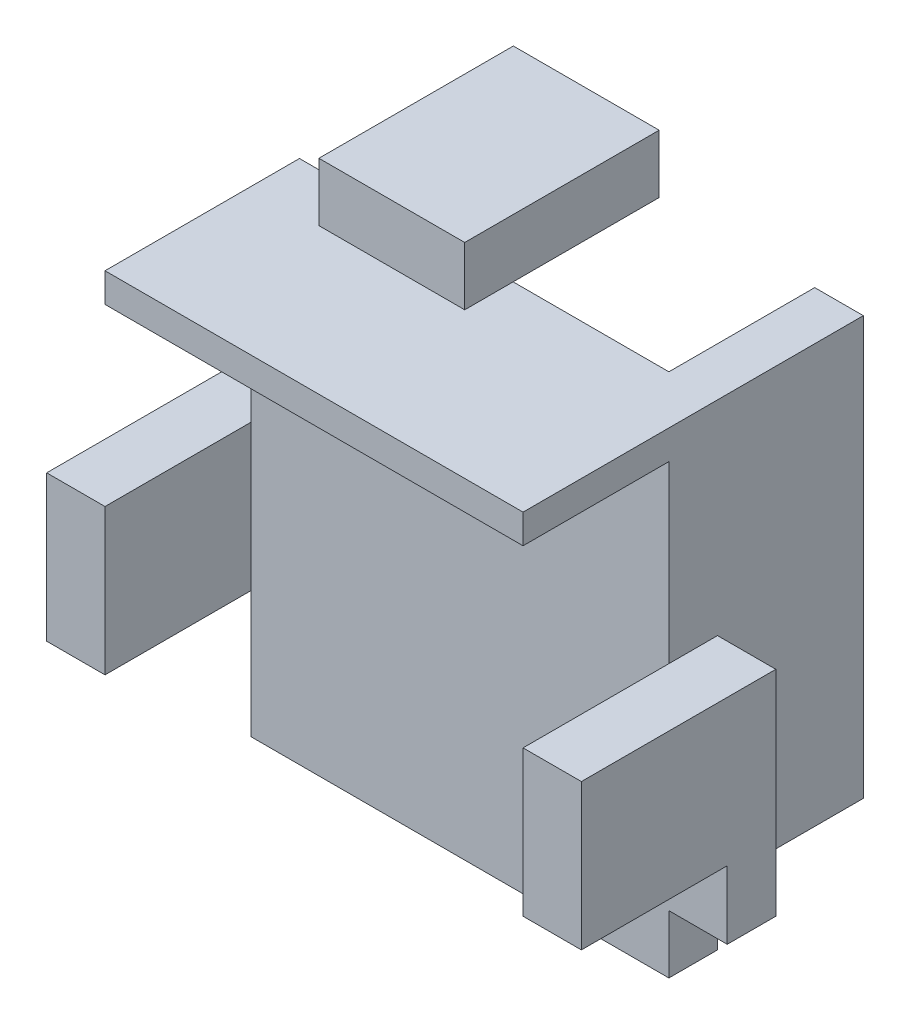
from build123d import *

# Parameters (mm, degrees)
SKETCH_1_W          = 6
SKETCH_1_H          = 15
EXTRUDE_3_DEPTH     = 15
SKETCH_1_7_W        = 6
SKETCH_1_7_H        = 15
EXTRUDE_3_2_DEPTH   = 15
EXTRUDE_4_DEPTH     = 15
SKETCH_1_11_W       = 18
SKETCH_1_11_H       = 18
SKETCH_1_11_W_2     = 6
SKETCH_1_11_H_2     = 15
SKETCH_1_11_W_3     = 15
SKETCH_1_11_H_3     = 6
SKETCH_1_11_W_4     = 7
EXTRUDE_5_DEPTH     = 5
SKETCH_1_13_W       = 3
SKETCH_1_13_H       = 40
EXTRUDE_10_DEPTH    = 20
SKETCH_3_W          = 14.869090603
SKETCH_3_H          = 6
EXTRUDE_15_DEPTH    = 15
SKETCH_4_W          = 22
SKETCH_4_H          = 6
SKETCH_4_W_2        = 7
CUT_EXTRUDE_2_DEPTH = 100.096671025
SKETCH_8_W          = 14.869090603
SKETCH_8_H          = 6
CUT_EXTRUDE_3_DEPTH = 104.17533721
SKETCH_10_W         = 15
SKETCH_10_H         = 6
EXTRUDE_16_DEPTH    = 20
SKETCH_15_W         = 7
SKETCH_15_H         = 6
EXTRUDE_17_DEPTH    = 5
SKETCH_16_W         = 15
SKETCH_16_H         = 6
EXTRUDE_18_DEPTH    = 20
SKETCH_17_W         = 3
SKETCH_17_H         = 40
CUT_EXTRUDE_5_DEPTH = 100.108727035
SKETCH_18_W         = 5
SKETCH_18_H         = 43
EXTRUDE_19_DEPTH    = 15


with BuildPart() as part:
    # 草图1 → Extrude 3 (new body)
    with BuildSketch(Plane.XY):
        with Locations((-25.796959303, 23.532605762)):
            Rectangle(SKETCH_1_W, SKETCH_1_H)
    extrude(amount=EXTRUDE_3_DEPTH)



with BuildPart() as body_2:
    # 草图1<7> → Extrude 3 2 (new body)
    with BuildSketch(Plane.XY):
        with Locations((-74.796959303, 23.532605762)):
            Rectangle(SKETCH_1_7_W, SKETCH_1_7_H)
    extrude(amount=EXTRUDE_3_2_DEPTH)


with BuildPart() as body_3:
    # 草图1<8> → 凸台-拉伸4 (new body)
    with BuildSketch(Plane.XY):
        Polygon((-71.796959303, 49.032605762), (-68.796959303, 49.032605762), (-50.796959303, 49.032605762), (-28.796959303, 49.032605762), (-28.796959303, 52.032605762), (-35.796959303, 52.032605762), (-50.796959303, 52.032605762), (-71.796959303, 52.032605762), align=None)
    extrude(amount=EXTRUDE_4_DEPTH)


with BuildPart() as part_1:
    add(part.part)

    add(body_2.part)  # 凸台-拉伸5 merges body 2

    add(body_3.part)  # 凸台-拉伸5 merges body 3
    # 草图1<11> → 凸台-拉伸5 (add)
    with BuildSketch(Plane.XY):
        Polygon((-68.796959303, 9.032605762), (-50.796959303, 9.032605762), (-35.796959303, 9.032605762), (-35.796959303, 3.032605762), (-28.796959303, 3.032605762), (-28.796959303, 9.032605762), (-22.796959303, 9.032605762), (-22.796959303, 16.032605762), (-28.796959303, 16.032605762), (-28.796959303, 31.032605762), (-28.796959303, 49.032605762), (-50.796959303, 49.032605762), (-50.796959303, 31.032605762), (-68.796959303, 31.032605762), align=None)
        with Locations((-59.796959303, 40.032605762)):
            Rectangle(SKETCH_1_11_W, SKETCH_1_11_H)
        with Locations((-25.796959303, 23.532605762)):
            Rectangle(SKETCH_1_11_W_2, SKETCH_1_11_H_2)
        with Locations((-74.796959303, 23.532605762)):
            Rectangle(SKETCH_1_11_W_2, SKETCH_1_11_H_2)
        Polygon((-71.796959303, 9.032605762), (-68.796959303, 9.032605762), (-68.796959303, 31.032605762), (-68.796959303, 49.032605762), (-71.796959303, 49.032605762), (-71.796959303, 31.032605762), (-71.796959303, 16.032605762), align=None)
        Polygon((-71.796959303, 49.032605762), (-68.796959303, 49.032605762), (-50.796959303, 49.032605762), (-28.796959303, 49.032605762), (-28.796959303, 52.032605762), (-35.796959303, 52.032605762), (-50.796959303, 52.032605762), (-71.796959303, 52.032605762), align=None)
        with Locations((-43.296959303, 55.032605762)):
            Rectangle(SKETCH_1_11_W_3, SKETCH_1_11_H_3)
        with Locations((-32.296959303, 55.032605762)):
            Rectangle(SKETCH_1_11_W_4, SKETCH_1_11_H_3)
        with Locations((-43.296959303, 6.032605762)):
            Rectangle(SKETCH_1_11_W_3, SKETCH_1_11_H_3)
    extrude(amount=-EXTRUDE_5_DEPTH)

    # 草图1<13> → 凸台-拉伸10 (add)
    with BuildSketch(Plane.XY):
        with Locations((-70.296959303, 29.032605762)):
            Rectangle(SKETCH_1_13_W, SKETCH_1_13_H)
    extrude(amount=-EXTRUDE_10_DEPTH)

    # 草图3 → 凸台-拉伸15 (add)
    with BuildSketch(Plane(origin=(0, 0, -5), x_dir=(-1, 0, 0), z_dir=(0, 0, -1))):
        with Locations((43.362414001, 55.032605762)):
            Rectangle(SKETCH_3_W, SKETCH_3_H)
        with Locations((43.362414001, 6.032605762)):
            Rectangle(SKETCH_3_W, SKETCH_3_H)
    extrude(amount=EXTRUDE_15_DEPTH)

    # 草图4 → 切除-拉伸2 (cut, through all)
    with BuildSketch(Plane(origin=(0, 0, -5), x_dir=(-1, 0, 0), z_dir=(0, 0, -1))):
        with Locations((39.796959303, 55.032605762)):
            Rectangle(SKETCH_4_W, SKETCH_4_H)
        with Locations((68.296959303, 55.032605762)):
            Rectangle(SKETCH_4_W_2, SKETCH_4_H)
    extrude(amount=-CUT_EXTRUDE_2_DEPTH, mode=Mode.SUBTRACT)


with BuildPart() as cut_extrude_2_piece_1:
    # of the separate pieces the step leaves, piece 1, a body of its own (cut_extrude_2_pieces)
    add(part_1.part.solids().sort_by_distance((-28.796959303, 31.032605762, 0))[0])

    # 草图15 → 凸台-拉伸17 (add)
    with BuildSketch(Plane.XY):
        with Locations((-68.296959303, 6.032605762)):
            Rectangle(SKETCH_15_W, SKETCH_15_H)
    extrude(amount=-EXTRUDE_17_DEPTH)

    # 草图16 → 凸台-拉伸18 (add)
    with BuildSketch(Plane.XY):
        with Locations((-57.296959303, 6.032605762)):
            Rectangle(SKETCH_16_W, SKETCH_16_H)
    extrude(amount=-EXTRUDE_18_DEPTH)

    # 草图17 → 切除-拉伸5 (cut, through all)
    with BuildSketch(Plane(origin=(0, 0, -5), x_dir=(-1, 0, 0), z_dir=(0, 0, -1))):
        with Locations((70.296959303, 29.032605762)):
            Rectangle(SKETCH_17_W, SKETCH_17_H)
    extrude(amount=CUT_EXTRUDE_5_DEPTH, mode=Mode.SUBTRACT)

    # 草图18 → 凸台-拉伸19 (add)
    with BuildSketch(Plane(origin=(0, 0, -5), x_dir=(-1, 0, 0), z_dir=(0, 0, -1))):
        with Locations((31.296959303, 30.532605762)):
            Rectangle(SKETCH_18_W, SKETCH_18_H)
    extrude(amount=EXTRUDE_19_DEPTH)


with BuildPart() as cut_extrude_2_piece_2:
    # of the separate pieces the step leaves, piece 2, a body of its own (cut_extrude_2_pieces)
    add(part_1.part.solids().sort_by_distance((-50.796959303, 52.032605762, -20))[0])

    # 草图8 → 切除-拉伸3 (cut, through all)
    with BuildSketch(Plane(origin=(0, 0, -20), x_dir=(-1, 0, 0), z_dir=(0, 0, -1))):
        with Locations((43.362414001, 55.032605762)):
            Rectangle(SKETCH_8_W, SKETCH_8_H)
    extrude(amount=-CUT_EXTRUDE_3_DEPTH, mode=Mode.SUBTRACT)


with BuildPart() as body_2_2:
    # 草图10 → 凸台-拉伸16 (new body)
    with BuildSketch(Plane.XY):
        with Locations((-57.296959303, 55.053190245)):
            Rectangle(SKETCH_10_W, SKETCH_10_H)
    extrude(amount=-EXTRUDE_16_DEPTH)


solid = Compound([cut_extrude_2_piece_1.part, body_2_2.part])
